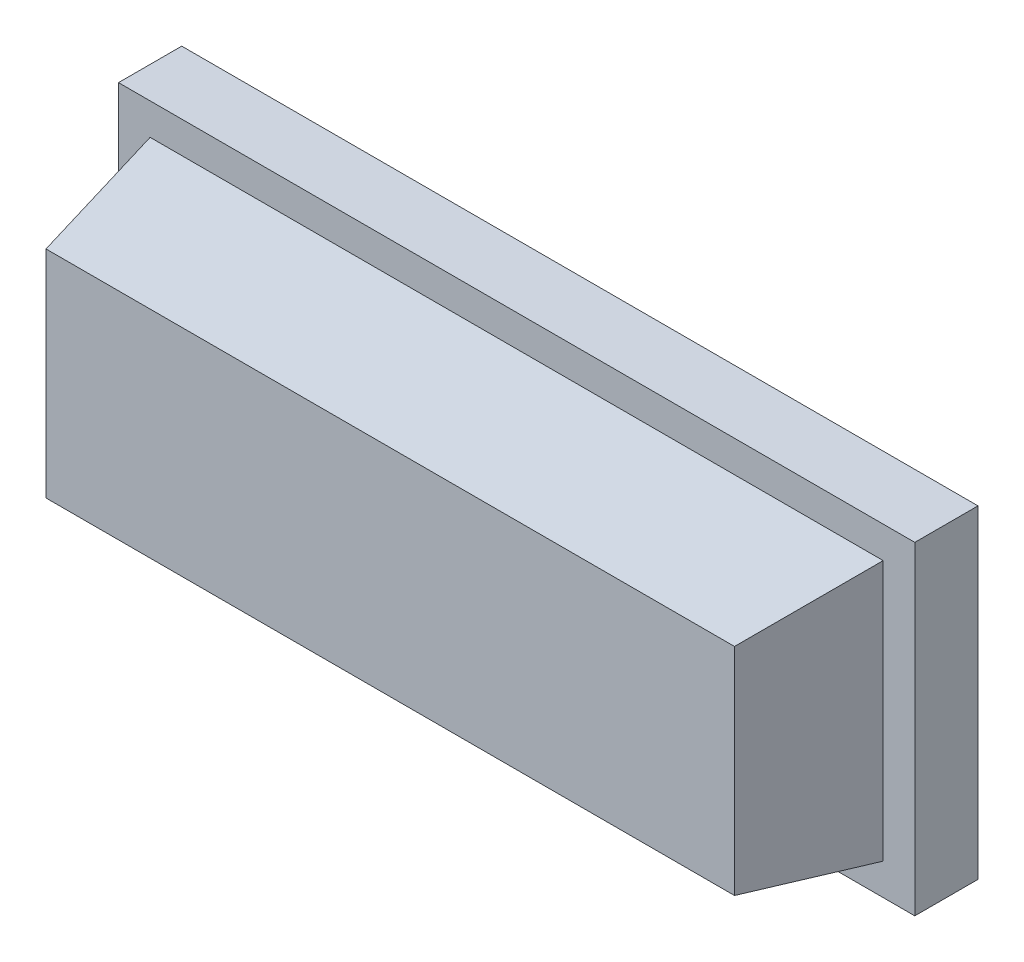
from build123d import *

# Parameters (mm, degrees)
SKETCH1_W           = 3.2
SKETCH1_H           = 1.3
BOSS_EXTRUDE1_DEPTH = 0.254
SKETCH2_W           = 2.946
SKETCH2_H           = 1.046
BOSS_EXTRUDE2_DEPTH = 0.508
BOSS_EXTRUDE2_TAPER = 10


with BuildPart() as part:
    # Sketch1 → Boss-Extrude1 (new body)
    with BuildSketch(Plane.XY):
        Rectangle(SKETCH1_W, SKETCH1_H)
    extrude(amount=BOSS_EXTRUDE1_DEPTH)

    # Sketch2 → Boss-Extrude2 (add)
    with BuildSketch(Plane.XY.offset(0.254)):
        Rectangle(SKETCH2_W, SKETCH2_H)
    extrude(amount=BOSS_EXTRUDE2_DEPTH, taper=BOSS_EXTRUDE2_TAPER)


solid = part.part
